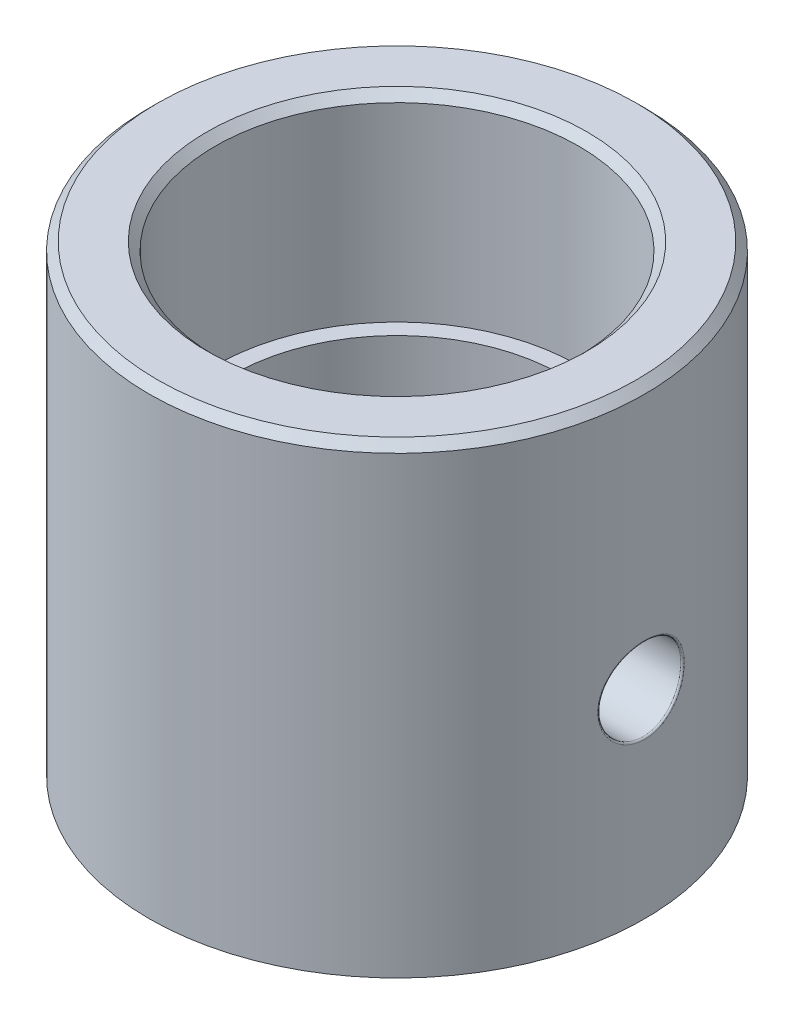
from build123d import *

# Parameters (mm, degrees)
CUT_EXTRUDE1_DEPTH      = 36.128336141
CUT_EXTRUDE1_DEPTH_BACK = 36.128336141
SKETCH2_R               = 2.5
CHAMFER1_SIZE           = 0.5
FILLET1_R               = 0.1


with BuildPart() as part:
    # Sketch1 → Revolve1 (revolve)
    with BuildSketch(Plane.XY, mode=Mode.PRIVATE) as revolve1_sk:
        Polygon((0, 0), (-15, 0), (-15, 28), (-11, 28), (-11, 16), (-10, 16), (-10, 1), (0, 1), align=None)
    revolve(revolve1_sk.sketch.rotate(Axis((0, 0, 0), (0, 1, 0)), 270), axis=Axis((0, 0, 0), (0, 1, 0)))

    # Sketch2 → Cut-Extrude1 (cut, two sides: drawn at the far end of the back side and taken through both)
    with BuildSketch(Plane(origin=(0, 0, 0), x_dir=(0, 0, -1), z_dir=(1, 0, 0)).offset(-CUT_EXTRUDE1_DEPTH_BACK)):
        with Locations((0, 12)):
            Circle(SKETCH2_R)
    extrude(amount=CUT_EXTRUDE1_DEPTH + CUT_EXTRUDE1_DEPTH_BACK, mode=Mode.SUBTRACT)

    # Chamfer1
    chamfer1_edges = [part.edges().sort_by_distance(p)[0] for p in [
        (0, 28, 11),
        (0, 28, 15),
    ]]
    chamfer(chamfer1_edges, length=CHAMFER1_SIZE)

    # Fillet1
    fillet1_edges = [part.edges().sort_by_distance(p)[0] for p in [
        (-14.790199451, 11.999999996, 2.500000054),
        (14.790199451, 11.999999996, 2.500000054),
    ]]
    fillet(fillet1_edges, radius=FILLET1_R)


solid = part.part
